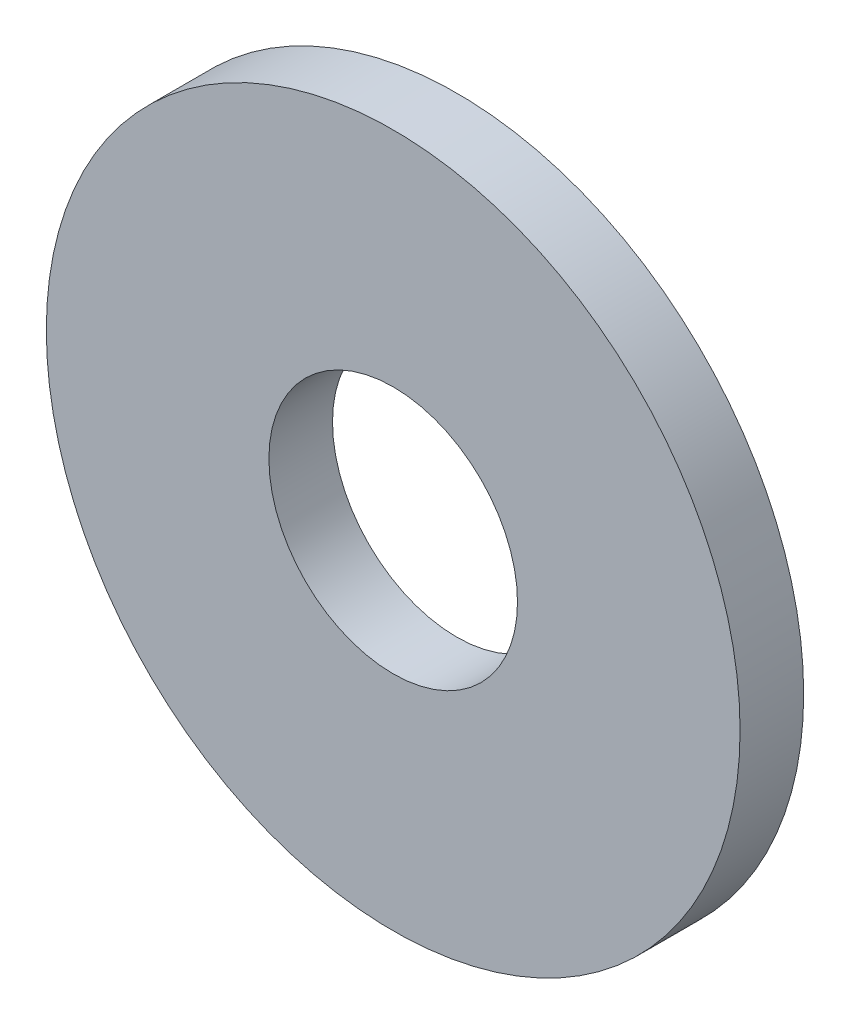
from build123d import *

# Parameters (mm, degrees)
SKETCH1_R           = 6
SKETCH1_R_2         = 2.15
BOSS_EXTRUDE1_DEPTH = 0.55


with BuildPart() as part:
    # Sketch1 → Boss-Extrude1 (new, symmetric)
    with BuildSketch(Plane.XY):
        Circle(SKETCH1_R)
        Circle(SKETCH1_R_2, mode=Mode.SUBTRACT)
    extrude(amount=BOSS_EXTRUDE1_DEPTH, both=True)


solid = part.part
